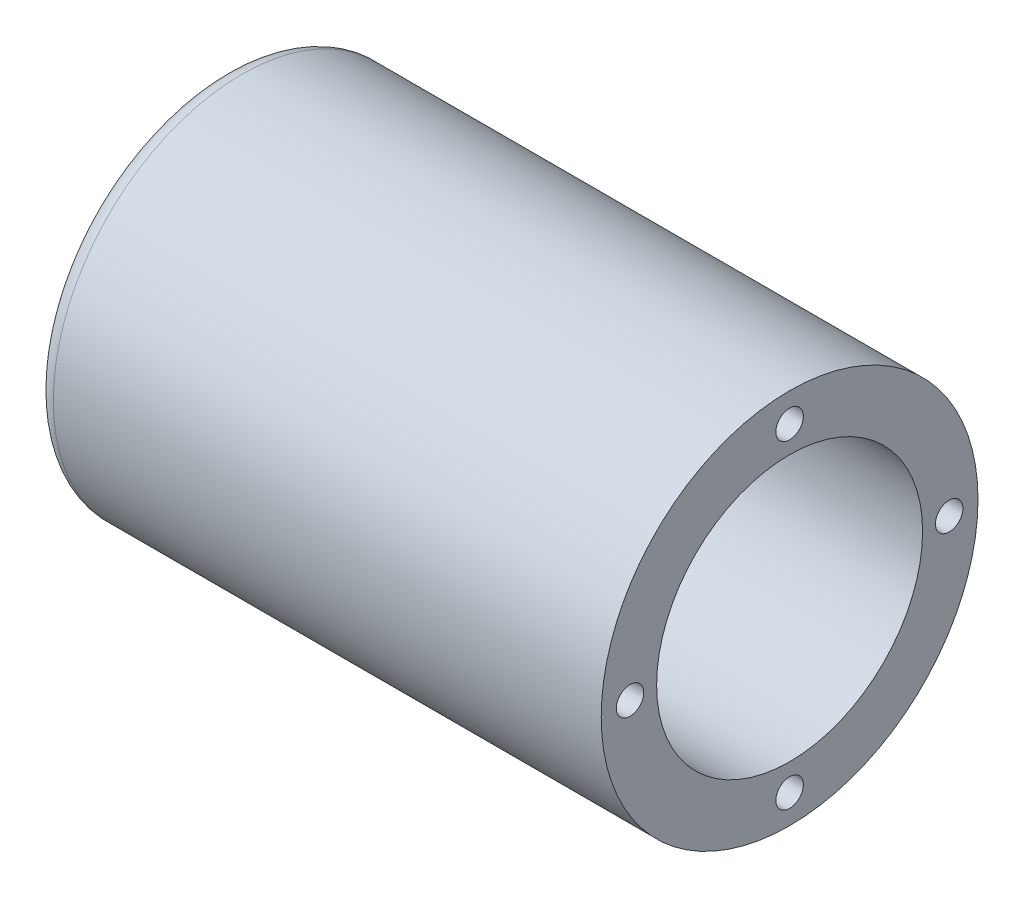
from build123d import *

# Parameters (mm, degrees)
SKETCH1_W          = 63.8
SKETCH1_H          = 21.25
SKETCH2_R          = 15
CUT_EXTRUDE1_DEPTH = 61.3
SKETCH3_R          = 1.55
CUT_EXTRUDE2_DEPTH = 3.8
CIRPATTERN1_COUNT  = 4
CUT_EXTRUDE3_REACH = 70.27
SKETCH4_R          = 1.8
CIRPATTERN2_COUNT  = 4
FILLET1_R          = 2


with BuildPart() as part:
    # Sketch1 → Revolve1 (revolve)
    with BuildSketch(Plane.XY):
        with Locations((0, 10.625)):
            Rectangle(SKETCH1_W, SKETCH1_H)
    revolve(axis=Axis((-31.9, 0, 0), (1, 0, 0)))

    # Sketch2 → Cut-Extrude1 (cut)
    with BuildSketch(Plane(origin=(31.9, 0, 0), x_dir=(0, 0, -1), z_dir=(1, 0, 0))):
        Circle(SKETCH2_R)
    extrude(amount=-CUT_EXTRUDE1_DEPTH, mode=Mode.SUBTRACT)

    # Sketch3 → Cut-Extrude2 (cut)
    with BuildSketch(Plane(origin=(31.9, 0, 0), x_dir=(0, 0, -1), z_dir=(1, 0, 0))):
        with Locations((0, 18)):
            Circle(SKETCH3_R)
    cut_extrude2 = extrude(amount=-CUT_EXTRUDE2_DEPTH, mode=Mode.SUBTRACT)

    # CirPattern1: Cut-Extrude2 ×4 about axis
    cirpattern1_axis = Axis((31.9, 0, 0), (-1, 0, 0))
    for i in range(1, CIRPATTERN1_COUNT):
        add(cut_extrude2.rotate(cirpattern1_axis, i * 360 / CIRPATTERN1_COUNT), mode=Mode.SUBTRACT)

    # Sketch4 → Cut-Extrude3 (cut, up to next)
    with BuildSketch(Plane(origin=(-29.4, 0, 0), x_dir=(0, 0, -1), z_dir=(1, 0, 0)), mode=Mode.PRIVATE) as cut_extrude3_sk1:
        with Locations((0, 12)):
            Circle(SKETCH4_R)
    cut_extrude3_tool1 = extrude(cut_extrude3_sk1.sketch, amount=-CUT_EXTRUDE3_REACH, mode=Mode.PRIVATE) & part.part
    cut_extrude3 = cut_extrude3_tool1.solids().sort_by_distance((-29.4, 12, 0))[0]
    add(cut_extrude3, mode=Mode.SUBTRACT)

    # CirPattern2: Cut-Extrude3 ×4 about axis
    cirpattern2_axis = Axis((-29.4, 0, 0), (1, 0, 0))
    for i in range(1, CIRPATTERN2_COUNT):
        add(cut_extrude3.rotate(cirpattern2_axis, i * 360 / CIRPATTERN2_COUNT), mode=Mode.SUBTRACT)

    # Fillet1
    fillet1_edges = [part.edges().sort_by_distance(p)[0] for p in [
        (-31.9, -21.25, 0),
    ]]
    fillet(fillet1_edges, radius=FILLET1_R)


solid = part.part
